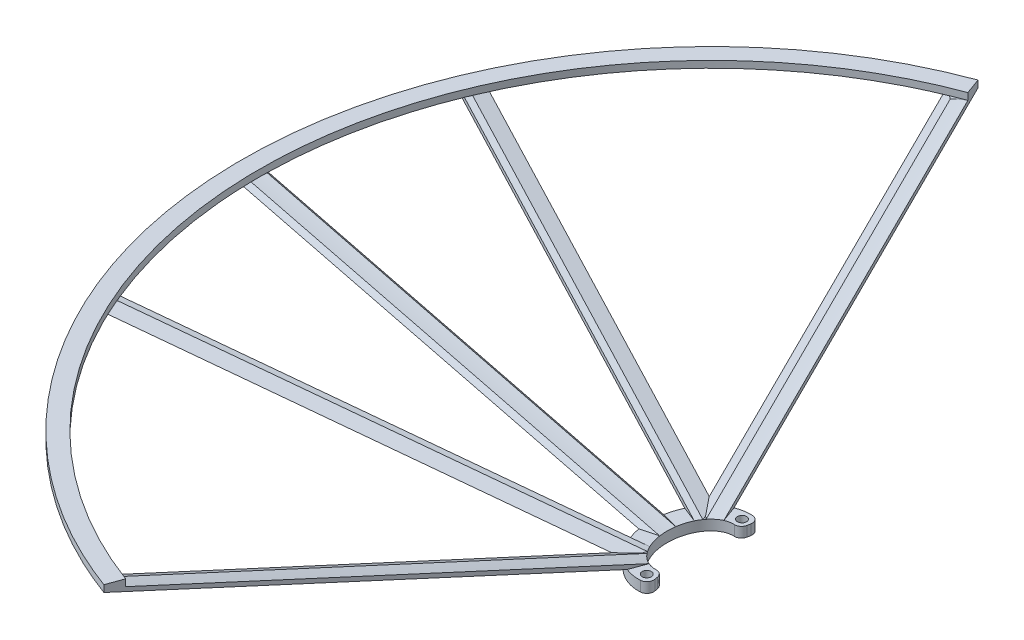
from build123d import *

# Parameters (mm, degrees)
BOSS_EXTRUDE1_DEPTH = 3
CUT_EXTRUDE1_REACH  = 23.219
SKETCH2_R           = 1.35
FILLET1_R           = 2
BOSS_EXTRUDE2_DEPTH = 2


with BuildPart() as part:
    # Sketch1 → Boss-Extrude1 (new body)
    with BuildSketch(Plane(origin=(0, 0, 0), x_dir=(1, 0, 0), z_dir=(0, 1, 0))):
        with BuildLine():
            Line((1.965601080218568, -11.147477670863005), (2.839162331404586, -16.10168971303812))
            add(Edge.make_bspline(
                [(2.8391623314044554, 16.10168971303816), (-13.000000000000089, 20.60085724196293), (-13.000000000000002, -7.999e-14), (-12.999999999999922, -20.600857241963105), (2.839162331404586, -16.10168971303812)],
                knots=[6.06301368817437, 6.06301368817437, 6.06301368817437, 7.853981633974488, 7.853981633974488, 9.644949579774607, 9.644949579774607, 9.644949579774607], degree=2, weights=[1, 0.625141143096608, 1, 0.625141143096608, 1]))
            Line((2.8391623314044554, 16.10168971303816), (1.9656010802184776, 11.147477670863038))
            add(Edge.make_bspline(
                [(1.9656010802184776, 11.147477670863038), (-8.00000000000006, 14.778575721031928), (-8, -7.642e-14), (-7.999999999999927, -14.778575721032079), (1.965601080218568, -11.147477670863005)],
                knots=[6.0349434049346256, 6.0349434049346256, 6.0349434049346256, 7.85398163397449, 7.85398163397449, 9.673019863014353, 9.673019863014353, 9.673019863014353], degree=2, weights=[1, 0.6141253393944448, 1, 0.6141253393944448, 1]))
        make_face()
    extrude(amount=BOSS_EXTRUDE1_DEPTH)

    # Sketch2 → Cut-Extrude1 (cut, up to next)
    with BuildSketch(Plane(origin=(0, 3, 0), x_dir=(1, 0, 0), z_dir=(0, 1, 0)), mode=Mode.PRIVATE) as cut_extrude1_sk1:
        with Locations(Location((0, -14, 0), (0, 0, 270))):
            Circle(SKETCH2_R)
    cut_extrude1_tool1 = extrude(cut_extrude1_sk1.sketch, amount=-CUT_EXTRUDE1_REACH, mode=Mode.PRIVATE) & part.part
    cut_extrude1 = cut_extrude1_tool1.solids().sort_by_distance((0, 3, 14))[0]
    add(cut_extrude1, mode=Mode.SUBTRACT)

    # Mirror1: Cut-Extrude1 across plane
    add(cut_extrude1.mirror(Plane.XY), mode=Mode.SUBTRACT)

    # Fillet1
    fillet1_edges = [part.edges().sort_by_distance(p)[0] for p in [
        (2.839162331404586, 1.5, 16.10168971303812),
        (1.965601080218568, 1.5, 11.147477670863005),
        (1.9656010802184776, 1.5, -11.147477670863038),
        (2.8391623314044554, 1.5, -16.10168971303816),
    ]]
    fillet(fillet1_edges, radius=FILLET1_R)

    # Sweep2: sweep along a path in Sketch7
    with BuildLine(Plane(origin=(0, 0, 0), x_dir=(-1, 0, 3.49e-15), z_dir=(-3.49e-15, 0, -1))) as sweep2_path:
        Line((10.254571092714382, 3.0000000000000004), (130.25457109271437, 33))
    # Sketch6 → Sweep2 (sweep)
    with BuildSketch(Plane(origin=(0, 3, 0), x_dir=(1, 0, 0), z_dir=(0, 1, 0))):
        with BuildLine():
            Line((-7.8310950190169235, -2.3506315431766196), (-12.678047166411817, -3.649368456823381))
            add(Edge.make_bspline(
                [(-12.678047166411817, 3.649368456823381), (-13.330128669006285, -6e-15), (-12.678047166411817, -3.649368456823381)],
                knots=[4.489371018725733, 4.489371018725733, 4.489371018725733, 4.935406942043648, 4.935406942043648, 4.935406942043648], degree=2, weights=[1, 0.9752343974162935, 1]))
            Line((-12.678047166411817, 3.649368456823381), (-7.8310950190169235, 2.3506315431766196))
            add(Edge.make_bspline(
                [(-7.8310950190169235, 2.3506315431766196), (-8.172548008239369, -6.01e-15), (-7.8310950190169235, -2.3506315431766196)],
                knots=[4.506535451089371, 4.506535451089371, 4.506535451089371, 4.918242509680009, 4.918242509680009, 4.918242509680009], degree=2, weights=[1, 0.9788868773771154, 1]))
        make_face()
    sweep(path=sweep2_path.line)

    # Sweep3: sweep along a path in Sketch5
    with BuildLine(Plane(origin=(1.4659233248398942, 0, 0.5335524559582682), x_dir=(0.34202014332566977, 0, -0.9396926207859081), z_dir=(0.939692620785908, 0, 0.3420201433256697))) as sweep3_path:
        Line((-16.118632311729026, 3), (-136.11863231172902, 33))
    # Sketch4 → Sweep3 (sweep)
    with BuildSketch(Plane(origin=(0, 3, 0), x_dir=(1, 0, 0), z_dir=(0, 1, 0))):
        with BuildLine():
            Line((-9.037727022183843, -11.860314021079231), (-5.247710191684228, -8.680112296451336))
            add(Edge.make_bspline(
                [(-5.247710191684228, -8.680112296451336), (-3.9659248063166106, -10.281422685616173), (-2.3421373751345973, -10.99611324105071)],
                knots=[5.5677265210915365, 5.5677265210915365, 5.5677265210915365, 5.9860657714248715, 5.9860657714248715, 5.9860657714248715], degree=2, weights=[1, 0.978203677371772, 1]))
            Line((-2.3421373751345973, -10.99611324105071), (-4.046973608631439, -15.680112296451336))
            add(Edge.make_bspline(
                [(-9.037727022183843, -11.860314021079231), (-6.8884537319288315, -14.49868497557548), (-4.046973608631439, -15.680112296451336)],
                knots=[5.51447361543868, 5.51447361543868, 5.51447361543868, 5.966618650189646, 5.966618650189646, 5.966618650189646], degree=2, weights=[1, 0.974554261015232, 1]))
        make_face()
    sweep3 = sweep(path=sweep3_path.line)

    # Sweep4: sweep along a path in Sketch19
    with BuildLine(Plane(origin=(1.3513202999421656, 0, 3.425998648216174), x_dir=(-0.9302523342127805, 0, 0.36692042010723985), z_dir=(-0.3669204201072398, 0, -0.9302523342127804))) as sweep4_path:
        Line((8.520088308934401, 3), (128.52008830893442, 33))
    # Sketch18 → Sweep4 (sweep)
    with BuildSketch(Plane(origin=(0, 3, 0), x_dir=(1, 0, 0), z_dir=(0, 1, 0))):
        with BuildLine():
            Line((-7.59351326016714, -13.39255334266312), (-5.655726214273211, -8.133349210983356))
            add(Edge.make_bspline(
                [(-6.574511737143085, -6.552193029881165), (-6.164580663426784, -7.4021625817580246), (-5.655726214273211, -8.133349210983356)],
                knots=[5.318597798182206, 5.318597798182206, 5.318597798182206, 5.497986534243405, 5.497986534243405, 5.497986534243405], degree=2, weights=[1, 0.9959801562531443, 1]))
            Line((-6.574511737143085, -6.552193029881165), (-11.200115283543903, -8.376674768947366))
            add(Edge.make_bspline(
                [(-11.200115283543903, -8.376674768947366), (-9.81231540309056, -11.365901577554983), (-7.59351326016714, -13.39255334266312)],
                knots=[5.2448756112240345, 5.2448756112240345, 5.2448756112240345, 5.659394290580302, 5.659394290580302, 5.659394290580302], degree=2, weights=[1, 0.978598558685246, 1]))
        make_face()
    sweep4 = sweep(path=sweep4_path.line)

    # Mirror2: Sweep3, Sweep4 across plane
    add(sweep3.mirror(Plane.XY))
    add(sweep4.mirror(Plane.XY))

    # Sketch8 → Boss-Extrude2 (add)
    with BuildSketch(Plane(origin=(0, 33, 0), x_dir=(1, 0, 0), z_dir=(0, 1, 0))):
        with BuildLine():
            Line((-43.38455457421316, 123.75922773536031), (-45.089390807711034, 128.44322679076058))
            add(Edge.make_bspline(
                [(-45.089390807711034, 128.44322679076058), (-392.30958066026284, 1.27887e-12), (-45.0893908077118, -128.4432267907603)],
                knots=[0.34587286060395406, 0.34587286060395406, 0.34587286060395406, 2.7957197929858326, 2.7957197929858326, 2.7957197929858326], degree=2, weights=[1, 0.3390179759978305, 1]))
            Line((-45.0893908077118, -128.4432267907603), (-43.38455457421491, -123.75922773535952))
            add(Edge.make_bspline(
                [(-43.38455457421316, 123.75922773536031), (-377.64591940141696, 2.69758e-12), (-43.38455457421491, -123.75922773535952)],
                knots=[0.3457919253322125, 0.3457919253322125, 0.3457919253322125, 2.795800728257566, 2.795800728257566, 2.795800728257566], degree=2, weights=[1, 0.3389418326110468, 1]))
        make_face()
    extrude(amount=BOSS_EXTRUDE2_DEPTH)


solid = part.part
